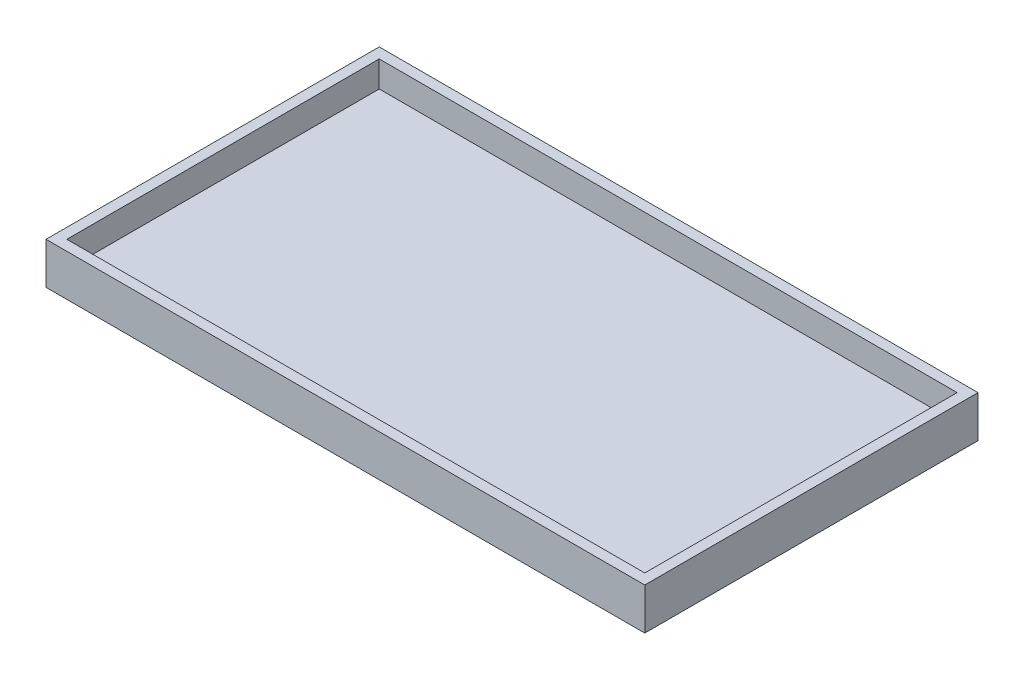
from build123d import *

# Parameters (mm, degrees)
SKETCH1_W           = 115
SKETCH1_H           = 64
BOSS_EXTRUDE1_DEPTH = 3
SKETCH2_W           = 115
SKETCH2_H           = 64
SKETCH2_W_2         = 111
SKETCH2_H_2         = 60
BOSS_EXTRUDE3_DEPTH = 5


with BuildPart() as part:
    # Sketch1 → Boss-Extrude1 (new body)
    with BuildSketch(Plane(origin=(0, 0, 0), x_dir=(1, 0, 0), z_dir=(0, 1, 0))):
        Rectangle(SKETCH1_W, SKETCH1_H)
    extrude(amount=BOSS_EXTRUDE1_DEPTH)

    # Sketch2 → Boss-Extrude3 (add)
    with BuildSketch(Plane(origin=(0, 3, 0), x_dir=(1, 0, 0), z_dir=(0, 1, 0))):
        Rectangle(SKETCH2_W, SKETCH2_H)
        Rectangle(SKETCH2_W_2, SKETCH2_H_2, mode=Mode.SUBTRACT)
    extrude(amount=BOSS_EXTRUDE3_DEPTH)


solid = part.part
